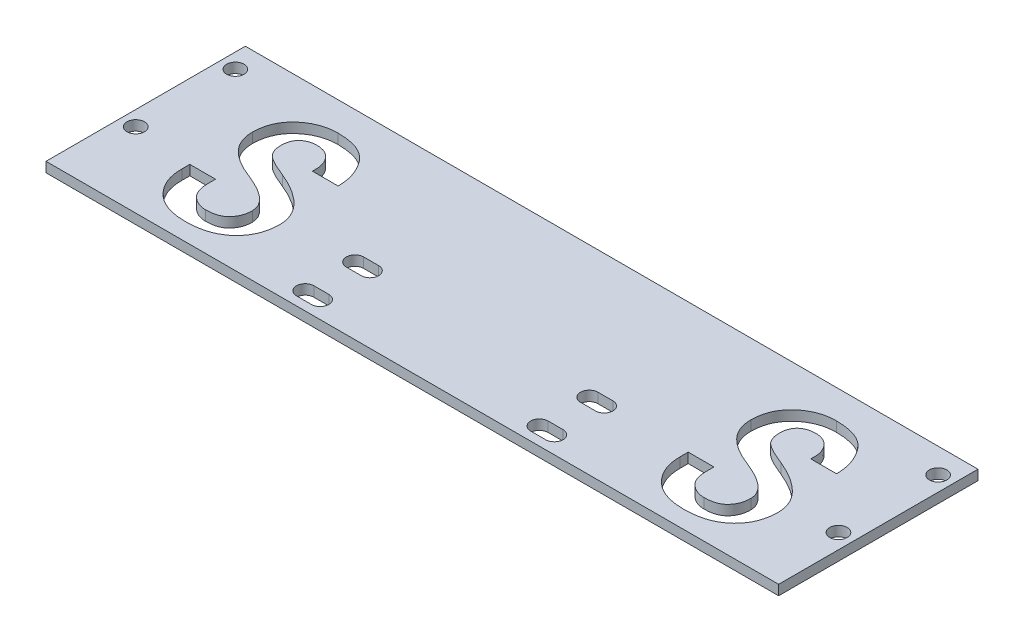
from build123d import *

# Parameters (mm, degrees)
SKETCH_1_W             = 147
SKETCH_1_H             = 62
EXTRUDE_1_DEPTH        = 2
SKETCH_2_R             = 1.75
CUT_EXTRUDE_1_DEPTH    = 80.795049972
CUT_EXTRUDE_2_DEPTH    = 80.795049972
PATTERN_LINEAR_1_COUNT = 2
PATTERN_LINEAR_1_PITCH = 100
SKETCH_5_W             = 147
SKETCH_5_H             = 12
CUT_EXTRUDE_3_DEPTH    = 10
SKETCH_6_W             = 147
SKETCH_6_H             = 10
CUT_EXTRUDE_4_DEPTH    = 80.795050105


with BuildPart() as part:
    # 草图1 → 凸台-拉伸1 (new body)
    with BuildSketch(Plane(origin=(0, 0, 0), x_dir=(1, 0, 0), z_dir=(0, 1, 0))):
        Rectangle(SKETCH_1_W, SKETCH_1_H)
    extrude(amount=EXTRUDE_1_DEPTH)

    # 草图2 → 切除-拉伸1 (cut, through all)
    with BuildSketch(Plane(origin=(0, 2, 0), x_dir=(1, 0, 0), z_dir=(0, 1, 0))):
        with Locations(Location((70.5, 26, 0), (0, 0, 270))):
            Circle(SKETCH_2_R)
        with Locations(Location((70.5, 6, 0), (0, 0, 270))):
            Circle(SKETCH_2_R)
        with Locations(Location((-70.5, 6, 0), (0, 0, 270))):
            Circle(SKETCH_2_R)
        with Locations(Location((-70.5, 26, 0), (0, 0, 270))):
            Circle(SKETCH_2_R)
        with BuildLine():
            Line((25, 2.75), (22, 2.75))
            ThreePointArc((22, 2.75), (20.25, 4.5), (22, 6.25))
            Line((22, 6.25), (25, 6.25))
            ThreePointArc((25, 6.25), (26.75, 4.5), (25, 2.75))
        make_face()
        with BuildLine():
            Line((25, -7.25), (22, -7.25))
            ThreePointArc((22, -7.25), (20.25, -5.5), (22, -3.75))
            Line((22, -3.75), (25, -3.75))
            ThreePointArc((25, -3.75), (26.75, -5.5), (25, -7.25))
        make_face()
        with BuildLine():
            Line((-25, 6.25), (-22, 6.25))
            ThreePointArc((-22, 6.25), (-20.25, 4.5), (-22, 2.75))
            Line((-22, 2.75), (-25, 2.75))
            ThreePointArc((-25, 2.75), (-26.75, 4.5), (-25, 6.25))
        make_face()
        with BuildLine():
            Line((-25, -3.75), (-22, -3.75))
            ThreePointArc((-22, -3.75), (-20.25, -5.5), (-22, -7.25))
            Line((-22, -7.25), (-25, -7.25))
            ThreePointArc((-25, -7.25), (-26.75, -5.5), (-25, -3.75))
        make_face()
    extrude(amount=-CUT_EXTRUDE_1_DEPTH, mode=Mode.SUBTRACT)

    # 草图4 → 切除-拉伸2 (cut, through all)
    with BuildSketch(Plane(origin=(0, 2, 0), x_dir=(1, 0, 0), z_dir=(0, 1, 0))):
        with BuildLine():
            add(Edge.make_bspline(
                [(-39.052640052, 3.459111397), (-39.058369557, 3.134485778), (-39.069573508, 2.499685809), (-39.20716373, 1.571503364), (-39.407794521, 0.687890094), (-39.698960301, -0.151313593), (-40.081216996, -0.937541442), (-40.543847982, -1.679319302), (-41.084711671, -2.376992748), (-41.710243203, -3.018519724), (-42.40552293, -3.602873847), (-43.177518422, -4.101391158), (-44.003746629, -4.539384071), (-44.899858501, -4.884788429), (-45.857043879, -5.155597162), (-46.878608498, -5.346226122), (-47.963791317, -5.464238672), (-48.708906443, -5.477871883), (-49.091274952, -5.484867997)],
                knots=[0, 0, 0, 0, 1.026257907, 2.006830171, 2.962246814, 3.890064445, 4.810370876, 5.722421915, 6.651580647, 7.597683975, 8.552400441, 9.518664622, 10.499801109, 11.506160626, 12.550923594, 13.643079996, 14.790506386, 16, 16, 16, 16], degree=3))
            add(Edge.make_bspline(
                [(-49.091274952, -5.484867997), (-49.452148543, -5.477681287), (-50.15439285, -5.463696262), (-51.178662613, -5.348466302), (-52.140153201, -5.14566059), (-53.047381711, -4.881290156), (-53.889510929, -4.522191278), (-54.672957737, -4.091733666), (-55.39323464, -3.577970108), (-56.047336774, -2.992876771), (-56.633791332, -2.349333159), (-57.14166411, -1.658829103), (-57.57924822, -0.932083834), (-57.933716898, -0.16570247), (-58.204057156, 0.642977557), (-58.405780726, 1.486900198), (-58.522226887, 2.374074041), (-58.536622683, 2.977986443), (-58.543947199, 3.285254346)],
                knots=[0, 0, 0, 0, 1.193018561, 2.321562216, 3.40162537, 4.438920661, 5.44067282, 6.422236786, 7.389118855, 8.359199127, 9.318734736, 10.262632676, 11.188836767, 12.119191402, 13.04830011, 14.003653799, 14.984268067, 16, 16, 16, 16], degree=3))
            Line((-58.543947199, 3.285254346), (-58.543947199, 4.895041854))
            Line((-58.543947199, 4.895041854), (-53.386188023, 4.895041854))
            Line((-53.386188023, 4.895041854), (-53.386188023, 3.459111397))
            add(Edge.make_bspline(
                [(-53.386188023, 3.459111397), (-53.383423595, 3.257122844), (-53.37805586, 2.864918472), (-53.309652798, 2.297047005), (-53.213281206, 1.769151363), (-53.059670981, 1.285669052), (-52.876698183, 0.841289348), (-52.64863858, 0.436265481), (-52.378778084, 0.071715989), (-51.959752201, -0.337177959), (-51.393865186, -0.765456011), (-50.663501807, -1.144646376), (-49.888461762, -1.376123297), (-49.358965873, -1.406438322), (-49.091274952, -1.421764327)],
                knots=[0, 0, 0, 0, 0.994138789, 1.93033503, 2.813467417, 3.632600764, 4.423770476, 5.176361867, 5.916301246, 6.64880386, 8.052580935, 9.395208834, 10.683126801, 12, 12, 12, 12], degree=3))
            add(Edge.make_bspline(
                [(-49.091274952, -1.421764327), (-48.887183553, -1.418848681), (-48.490783462, -1.413185717), (-47.918028418, -1.347037182), (-47.386301513, -1.244000561), (-46.895752768, -1.107853689), (-46.453304281, -0.915783887), (-46.049223431, -0.693425746), (-45.693011786, -0.418166347), (-45.273810404, -0.00718262), (-44.848818139, 0.581537554), (-44.471688178, 1.363023538), (-44.247439774, 2.219039657), (-44.222925822, 2.813875954), (-44.210399227, 3.117836446)],
                knots=[0, 0, 0, 0, 0.971428041, 1.886773118, 2.740655993, 3.54930072, 4.30485501, 5.032520431, 5.739803091, 6.440855371, 7.82273612, 9.171295201, 10.55453592, 12, 12, 12, 12], degree=3))
            add(Edge.make_bspline(
                [(-44.210399227, 3.117836446), (-44.228107098, 3.3713406), (-44.26407227, 3.886214501), (-44.555566237, 4.636143402), (-45.020548732, 5.354499761), (-45.666698974, 6.048250594), (-46.499019173, 6.717867372), (-47.520188972, 7.372305262), (-48.733228928, 8.015077749), (-49.624707921, 8.396174408), (-50.095782357, 8.597553123)],
                knots=[0, 0, 0, 0, 0.715380919, 1.452958298, 2.244527468, 3.125416911, 4.121977031, 5.258627686, 6.551406792, 8, 8, 8, 8], degree=3))
            add(Edge.make_bspline(
                [(-50.095782357, 8.597553123), (-50.420717881, 8.724276127), (-51.051047469, 8.970101076), (-51.957443743, 9.362881779), (-52.796405032, 9.773917055), (-53.565795517, 10.205293917), (-54.274376418, 10.642522568), (-54.911499077, 11.098308084), (-55.480987494, 11.570353775), (-55.988097607, 12.053676722), (-56.43012449, 12.560043129), (-56.812588478, 13.089907572), (-57.134480822, 13.644949813), (-57.40183212, 14.221991999), (-57.607837187, 14.824164701), (-57.758106492, 15.451152199), (-57.839745622, 16.103456029), (-57.854126841, 16.545405867), (-57.861397296, 16.768834514)],
                knots=[0, 0, 0, 0, 1.385538574, 2.687751546, 3.923348175, 5.095308518, 6.190818142, 7.229672453, 8.204653253, 9.127369857, 10.009763995, 10.871183968, 11.719462109, 12.555044509, 13.393710489, 14.24378683, 15.112142833, 16, 16, 16, 16], degree=3))
            add(Edge.make_bspline(
                [(-57.861397296, 16.768834514), (-57.854888287, 17.076199384), (-57.842179305, 17.676336032), (-57.715934644, 18.554606861), (-57.510187166, 19.387077648), (-57.227222302, 20.175639013), (-56.863597772, 20.920869342), (-56.409442545, 21.615542826), (-55.878697264, 22.26950188), (-55.274550152, 22.871327736), (-54.614877656, 23.413671401), (-53.919137638, 23.894179165), (-53.186368296, 24.294637326), (-52.424961062, 24.622728984), (-51.635209477, 24.884742442), (-50.812510311, 25.061845116), (-49.961545118, 25.174810008), (-49.383542066, 25.190000724), (-49.091274952, 25.197681906)],
                knots=[0, 0, 0, 0, 1.0851237, 2.118727819, 3.126397254, 4.109670587, 5.07262421, 6.048386153, 7.034723786, 8.042592853, 9.055070971, 10.047653608, 11.024857746, 11.999470295, 12.972873042, 13.958860951, 14.967898497, 16, 16, 16, 16], degree=3))
            add(Edge.make_bspline(
                [(-49.091274952, 25.197681906), (-48.691610753, 25.189847692), (-47.919883564, 25.174720302), (-46.80821522, 25.036193906), (-45.782604815, 24.821110361), (-44.844675183, 24.515547854), (-43.997169023, 24.111688171), (-43.236607803, 23.623708933), (-42.573362621, 23.034895433), (-42.001247394, 22.368510737), (-41.514705479, 21.646538537), (-41.078529213, 20.907160502), (-40.716381676, 20.141393851), (-40.421440657, 19.356866262), (-40.186843504, 18.552146108), (-40.018450017, 17.725530427), (-39.921487548, 16.876349594), (-39.908920603, 16.303309122), (-39.902607856, 16.01545396)],
                knots=[0, 0, 0, 0, 1.302674875, 2.515385722, 3.646489207, 4.715455019, 5.72345844, 6.699892586, 7.651918048, 8.604612122, 9.55583978, 10.487320937, 11.401445266, 12.313960692, 13.217630151, 14.13175448, 15.061525072, 16, 16, 16, 16], degree=3))
            Line((-39.902607856, 16.01545396), (-45.066806182, 16.01545396))
            add(Edge.make_bspline(
                [(-45.066806182, 16.01545396), (-45.052831539, 16.35928789), (-45.026034294, 17.018610809), (-45.17686294, 17.971123639), (-45.483215411, 18.831897231), (-45.887168456, 19.454486535), (-46.261636877, 19.896074742), (-46.579788807, 20.182538663), (-46.931328895, 20.41917896), (-47.303750362, 20.623392349), (-47.711079501, 20.770041853), (-48.144616473, 20.878408904), (-48.607903385, 20.953714064), (-48.927842071, 20.958352005), (-49.091274952, 20.960721185)],
                knots=[0, 0, 0, 0, 1.697450499, 3.254966772, 4.735083127, 6.180148285, 6.894731882, 7.593387837, 8.287842769, 8.985531501, 9.687081119, 10.420398074, 11.193098849, 12, 12, 12, 12], degree=3))
            add(Edge.make_bspline(
                [(-49.091274952, 20.960721185), (-49.347801419, 20.950691102), (-49.841538806, 20.931386166), (-50.545199872, 20.752313123), (-51.174530729, 20.46045226), (-51.724370571, 20.051610916), (-52.172682082, 19.521927782), (-52.483768758, 18.867967488), (-52.670755406, 18.107735312), (-52.692285523, 17.56415263), (-52.70363812, 17.277527366)],
                knots=[0, 0, 0, 0, 1.050820751, 2.022518361, 2.956085645, 3.88064, 4.811878975, 5.772744392, 6.825592226, 8, 8, 8, 8], degree=3))
            add(Edge.make_bspline(
                [(-52.70363812, 17.277527366), (-52.694859761, 17.036217322), (-52.677795165, 16.567125222), (-52.513806065, 15.896734294), (-52.242925054, 15.29284039), (-51.936599202, 14.829239016), (-51.593788704, 14.491731789), (-51.252585868, 14.224475838), (-50.819873845, 13.94947614), (-50.308375423, 13.653288618), (-49.704235915, 13.355474427), (-49.024755096, 13.03056598), (-48.252892036, 12.704823924), (-47.709329272, 12.485966039), (-47.423535093, 12.370895042)],
                knots=[0, 0, 0, 0, 1.115479074, 2.168423712, 3.169032593, 4.169296207, 4.71721719, 5.389015533, 6.171560352, 7.088321403, 8.123495142, 9.287804716, 10.573983217, 12, 12, 12, 12], degree=3))
            add(Edge.make_bspline(
                [(-47.423535093, 12.370895042), (-47.091696211, 12.232170663), (-46.443603977, 11.961237397), (-45.514245945, 11.51430336), (-44.646804381, 11.051726155), (-43.835107674, 10.576208915), (-43.090628387, 10.072151393), (-42.400550799, 9.559453363), (-41.769329724, 9.0294592), (-41.205275974, 8.476697911), (-40.697866174, 7.909369824), (-40.260504815, 7.322029978), (-39.881551375, 6.722198139), (-39.578482564, 6.102180775), (-39.34435864, 5.465250275), (-39.177603497, 4.811599022), (-39.069303002, 4.140976723), (-39.058210015, 3.687040114), (-39.052640052, 3.459111397)],
                knots=[0, 0, 0, 0, 1.329306622, 2.596179482, 3.810071124, 4.96256867, 6.071617761, 7.131592304, 8.139326642, 9.115555021, 10.048526088, 10.949822194, 11.819411578, 12.667452081, 13.495778931, 14.323231398, 15.158068091, 16, 16, 16, 16], degree=3))
        make_face()
    cut_extrude_2 = extrude(amount=-CUT_EXTRUDE_2_DEPTH, mode=Mode.SUBTRACT)

    # 阵列(线性)1: 切除-拉伸2 ×2
    with Locations(*[(i * PATTERN_LINEAR_1_PITCH, 0, 0) for i in range(1, PATTERN_LINEAR_1_COUNT)]):
        add(cut_extrude_2, mode=Mode.SUBTRACT)

    # 草图5 → 切除-拉伸3 (cut)
    with BuildSketch(Plane(origin=(0, 2, 0), x_dir=(1, 0, 0), z_dir=(0, 1, 0))):
        with Locations((0, -25)):
            Rectangle(SKETCH_5_W, SKETCH_5_H)
    extrude(amount=-CUT_EXTRUDE_3_DEPTH, mode=Mode.SUBTRACT)

    # 草图6 → 切除-拉伸4 (cut, through all)
    with BuildSketch(Plane(origin=(0, 2, 0), x_dir=(1, 0, 0), z_dir=(0, 1, 0))):
        with Locations((0, -14)):
            Rectangle(SKETCH_6_W, SKETCH_6_H)
    extrude(amount=-CUT_EXTRUDE_4_DEPTH, mode=Mode.SUBTRACT)


solid = part.part
